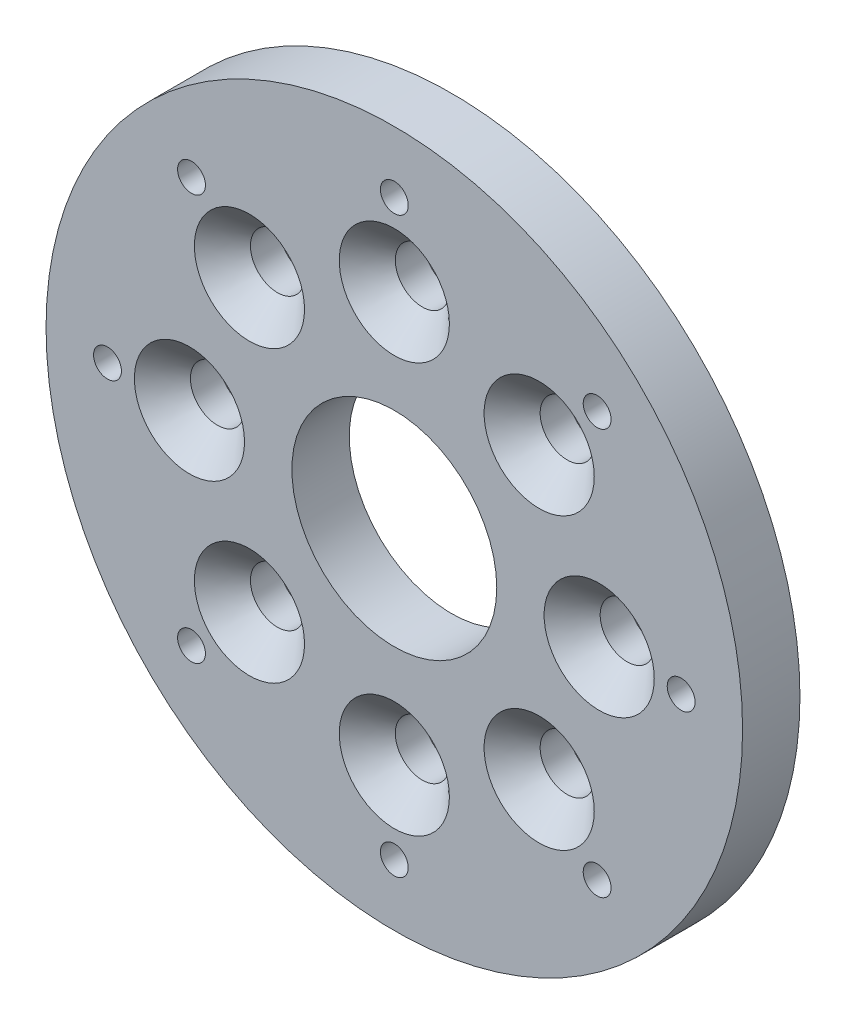
from build123d import *

# Parameters (mm, degrees)
CROQUIS1_R                                           = 42.5
CROQUIS1_R_2                                         = 12.5
SALIENTE_EXTRUIR1_DEPTH                              = 7
REFRENTADO_PARA_TORNILLO_TAP_N_CON_CABEZ_D           = 6.6
REFRENTADO_PARA_TORNILLO_TAP_N_CON_CABEZ_DEPTH       = 10
REFRENTADO_PARA_TORNILLO_TAP_N_CON_CABEZ_CSINK_D     = 13.44
REFRENTADO_PARA_TORNILLO_TAP_N_CON_CABEZ_CSINK_ANGLE = 90
REFRENTADO_PARA_TORNILLO_TAP_N_CON_CABEZ_TIP         = 1.982840043
REFRENTADO_PARA_TORNILLO_CON_CABEZA_TRON_D           = 3.4
REFRENTADO_PARA_TORNILLO_CON_CABEZA_TRON_DEPTH       = 10
REFRENTADO_PARA_TORNILLO_CON_CABEZA_TRON_CBORE_D     = 7
REFRENTADO_PARA_TORNILLO_CON_CABEZA_TRON_CBORE_DEPTH = 2.4
REFRENTADO_PARA_TORNILLO_CON_CABEZA_TRON_TIP         = 1.021463052


with BuildPart() as part:
    # Croquis1 → Saliente-Extruir1 (new body)
    with BuildSketch(Plane.XY):
        Circle(CROQUIS1_R)
        Circle(CROQUIS1_R_2, mode=Mode.SUBTRACT)
    extrude(amount=SALIENTE_EXTRUIR1_DEPTH)

    # Refrentado para tornillo tapón con cabeza plana de clavija de M61
    with Locations(Plane.XY.offset(7)):
        with Locations((0, 25), (17.67766953, 17.67766953), (25, 0), (17.67766953, -17.67766953), (0, -25), (-17.67766953, -17.67766953), (-25, 0), (-17.67766953, 17.67766953)):
            CounterSinkHole(REFRENTADO_PARA_TORNILLO_TAP_N_CON_CABEZ_D / 2, REFRENTADO_PARA_TORNILLO_TAP_N_CON_CABEZ_CSINK_D / 2, depth=REFRENTADO_PARA_TORNILLO_TAP_N_CON_CABEZ_DEPTH, counter_sink_angle=REFRENTADO_PARA_TORNILLO_TAP_N_CON_CABEZ_CSINK_ANGLE)
            with Locations((0, 0, -(REFRENTADO_PARA_TORNILLO_TAP_N_CON_CABEZ_DEPTH + REFRENTADO_PARA_TORNILLO_TAP_N_CON_CABEZ_TIP / 2))):  # 118° drill point
                Cone(0, REFRENTADO_PARA_TORNILLO_TAP_N_CON_CABEZ_D / 2, REFRENTADO_PARA_TORNILLO_TAP_N_CON_CABEZ_TIP, mode=Mode.SUBTRACT)

    # Refrentado para tornillo con cabeza troncocónica de M32
    with Locations(Plane(origin=(0, 0, 0), x_dir=(-1, 0, 0), z_dir=(0, 0, -1))):
        with Locations((0, 35), (24.748737342, 24.748737342), (35, 0), (24.748737342, -24.748737342), (0, -35), (-24.748737342, -24.748737342), (-35, 0), (-24.748737342, 24.748737342)):
            CounterBoreHole(REFRENTADO_PARA_TORNILLO_CON_CABEZA_TRON_D / 2, REFRENTADO_PARA_TORNILLO_CON_CABEZA_TRON_CBORE_D / 2, REFRENTADO_PARA_TORNILLO_CON_CABEZA_TRON_CBORE_DEPTH, depth=REFRENTADO_PARA_TORNILLO_CON_CABEZA_TRON_DEPTH)
            with Locations((0, 0, -(REFRENTADO_PARA_TORNILLO_CON_CABEZA_TRON_DEPTH + REFRENTADO_PARA_TORNILLO_CON_CABEZA_TRON_TIP / 2))):  # 118° drill point
                Cone(0, REFRENTADO_PARA_TORNILLO_CON_CABEZA_TRON_D / 2, REFRENTADO_PARA_TORNILLO_CON_CABEZA_TRON_TIP, mode=Mode.SUBTRACT)


solid = part.part
